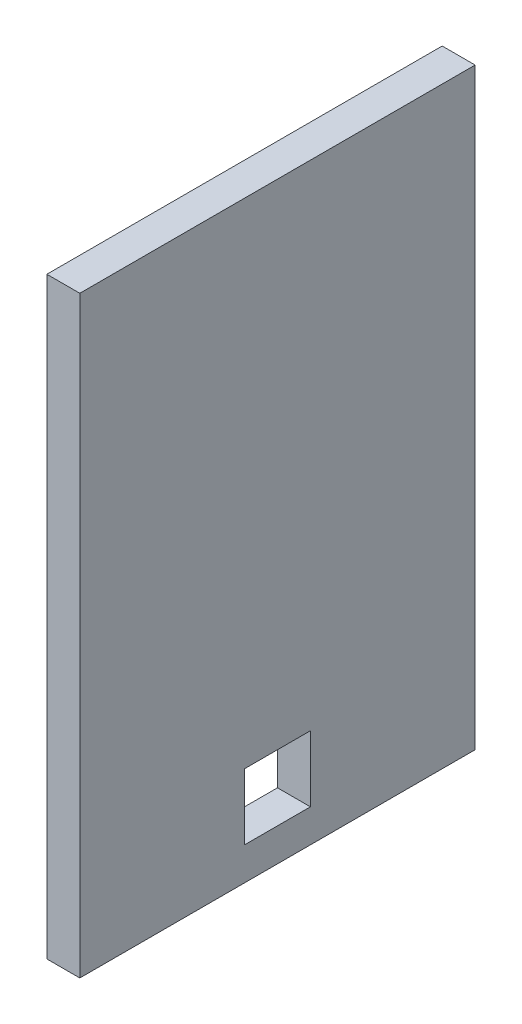
from build123d import *

# Parameters (mm, degrees)
CROQUIS1_W              = 304.8
CROQUIS1_H              = 304.8
SALIENTE_EXTRUIR1_DEPTH = 25.4
CROQUIS3_W              = 50.8
CROQUIS3_H              = 50.8
CORTAR_EXTRUIR2_DEPTH   = 25.4
SKETCH1_W               = 25.4
SKETCH1_H               = 304.8
BOSS_EXTRUDE1_DEPTH     = 152.4


with BuildPart() as part:
    # Croquis1 → Saliente-Extruir1 (new body)
    with BuildSketch(Plane(origin=(0, 0, 0), x_dir=(0, 0, -1), z_dir=(1, 0, 0))):
        with Locations((0, 152.4)):
            Rectangle(CROQUIS1_W, CROQUIS1_H)
    extrude(amount=-SALIENTE_EXTRUIR1_DEPTH)

    # Croquis3 → Cortar-Extruir2 (cut)
    with BuildSketch(Plane(origin=(0, 0, 0), x_dir=(0, 0, -1), z_dir=(1, 0, 0))):
        with Locations((0, 50.8)):
            Rectangle(CROQUIS3_W, CROQUIS3_H)
    extrude(amount=-CORTAR_EXTRUIR2_DEPTH, mode=Mode.SUBTRACT)

    # Sketch1 → Boss-Extrude1 (add)
    with BuildSketch(Plane(origin=(0, 304.8, 0), x_dir=(1, 0, 0), z_dir=(0, 1, 0))):
        with Locations((-12.7, 0)):
            Rectangle(SKETCH1_W, SKETCH1_H)
    extrude(amount=BOSS_EXTRUDE1_DEPTH)


solid = part.part
